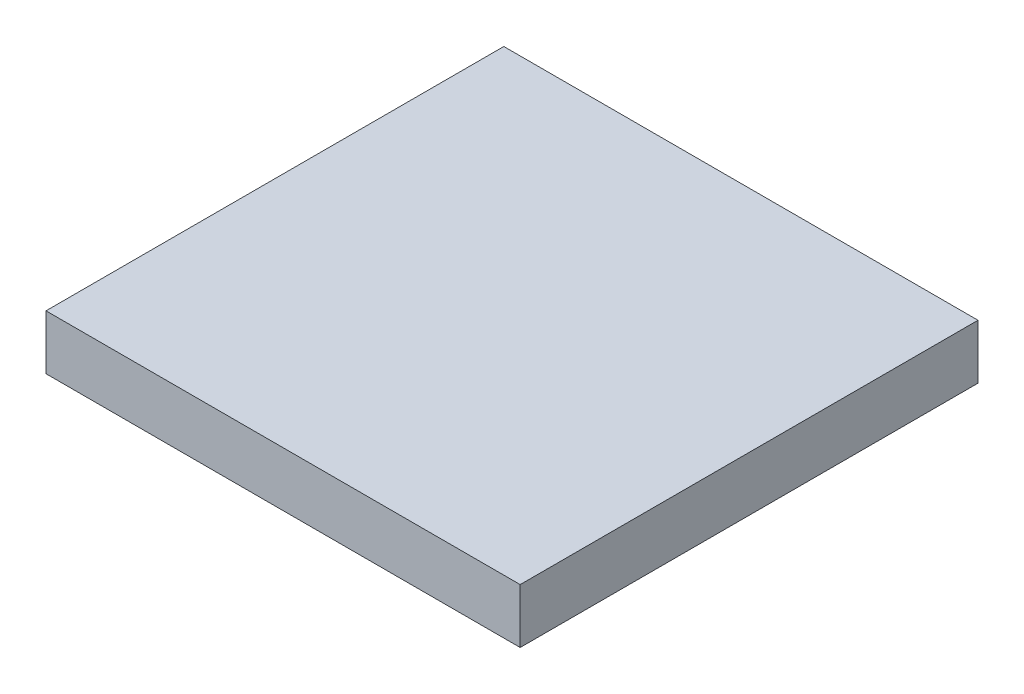
from build123d import *

# Parameters (mm, degrees)
SKETCH1_W           = 87
SKETCH1_H           = 84
BOSS_EXTRUDE1_DEPTH = 10


with BuildPart() as part:
    # Sketch1 → Boss-Extrude1 (new body)
    with BuildSketch(Plane(origin=(0, 0, 0), x_dir=(1, 0, 0), z_dir=(0, 1, 0))):
        Rectangle(SKETCH1_W, SKETCH1_H)
    extrude(amount=BOSS_EXTRUDE1_DEPTH)


solid = part.part
